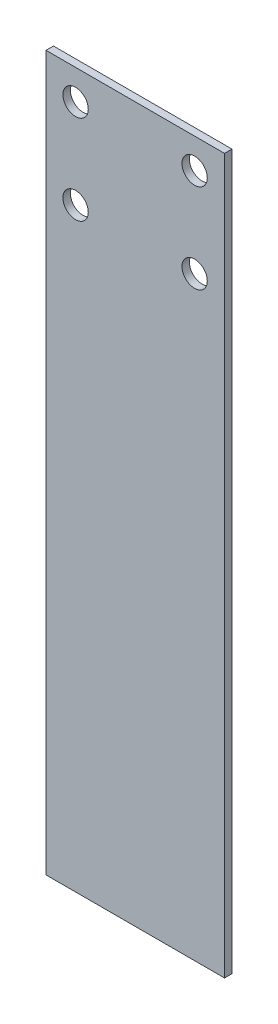
from build123d import *

# Parameters (mm, degrees)
SKETCH1_W           = 76.2
SKETCH1_H           = 304.8
BOSS_EXTRUDE1_DEPTH = 3.175
SKETCH2_R           = 5.406348713
CUT_EXTRUDE3_DEPTH  = 3.175


with BuildPart() as part:
    # Sketch1 → Boss-Extrude1 (new body)
    with BuildSketch(Plane.XY):
        with Locations((-36.3140625, -78.87890625)):
            Rectangle(SKETCH1_W, SKETCH1_H)
    extrude(amount=BOSS_EXTRUDE1_DEPTH)

    # Sketch2 → Cut-Extrude3 (cut)
    with BuildSketch(Plane.XY.offset(3.175)):
        with Locations((-61.790440279, 60.741729321)):
            Circle(SKETCH2_R)
        with Locations((-10.990440279, 60.741729321)):
            Circle(SKETCH2_R)
        with Locations((-61.790440279, 22.641729321)):
            Circle(SKETCH2_R)
        with Locations((-10.990440279, 22.641729321)):
            Circle(SKETCH2_R)
    extrude(amount=-CUT_EXTRUDE3_DEPTH, mode=Mode.SUBTRACT)


solid = part.part
